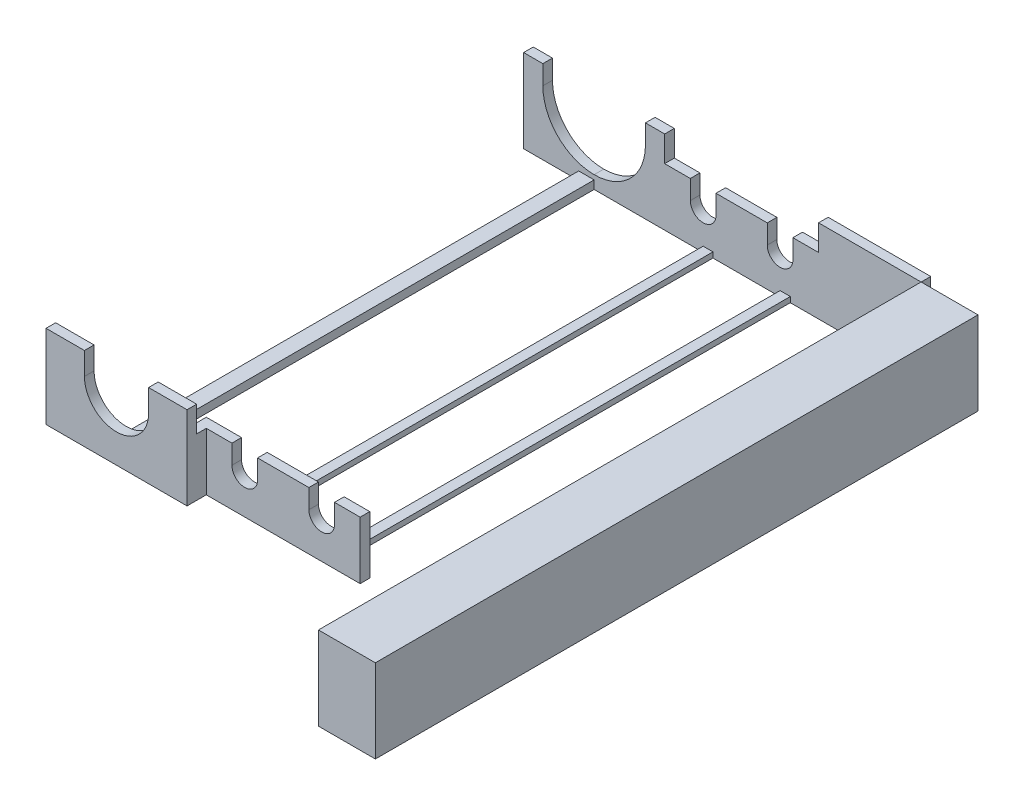
from build123d import *

# Parameters (mm, degrees)
CROQUIS1_W                 = 22
CROQUIS1_H                 = 13
SALIENTE_EXTRUIR1_DEPTH    = 1.5
CORTAR_EXTRUIR1_DEPTH      = 26.597851472
CORTAR_EXTRUIR1_DEPTH_BACK = 26.597851472
CROQUIS3_W                 = 2.414138677
CROQUIS3_H                 = 1.29532468
SALIENTE_EXTRUIR2_DEPTH    = 73
SALIENTE_EXTRUIR3_DEPTH    = 1.5
SALIENTE_EXTRUIR4_DEPTH    = 1.5
SALIENTE_EXTRUIR6_DEPTH    = 1.5
CROQUIS11_W                = 1.535403859
CROQUIS11_H                = 0.841260835
CROQUIS11_W_2              = 1.596700718
SALIENTE_EXTRUIR8_DEPTH    = 70
SALIENTE_EXTRUIR9_START    = 1.5
SALIENTE_EXTRUIR9_DEPTH    = 1.5
CROQUIS13_W                = 3
CROQUIS13_H                = 8.989544026
SALIENTE_EXTRUIR10_DEPTH   = 1.5
CROQUIS16_W                = 16
CROQUIS16_H                = 13
SALIENTE_EXTRUIR11_DEPTH   = 1.5
CROQUIS17_W                = 8.872396733
CROQUIS17_H                = 13
SALIENTE_EXTRUIR13_DEPTH   = 94


with BuildPart() as part:
    # Croquis1 → Saliente-Extruir1 (new body)
    with BuildSketch(Plane.XY):
        with Locations((11, 6.5)):
            Rectangle(CROQUIS1_W, CROQUIS1_H)
    extrude(amount=SALIENTE_EXTRUIR1_DEPTH)

    # Croquis2 → Cortar-Extruir1 (cut, two sides: drawn at the far end of the back side and taken through both)
    with BuildSketch(Plane.XY.offset(1.5).offset(-CORTAR_EXTRUIR1_DEPTH_BACK)):
        with BuildLine():
            Line((3, 13), (3, 10))
            ThreePointArc((3, 10), (5.343145751, 4.343145751), (11, 2))
            ThreePointArc((11, 2), (16.656854249, 4.343145751), (19, 10))
            Line((19, 10), (19, 13))
            Line((19, 13), (3, 13))
        make_face()
    extrude(amount=CORTAR_EXTRUIR1_DEPTH + CORTAR_EXTRUIR1_DEPTH_BACK, mode=Mode.SUBTRACT)

    # Croquis3 → Saliente-Extruir2 (add)
    with BuildSketch(Plane.XY.offset(1.5)):
        with Locations((9.792930662, 0.64766234)):
            Rectangle(CROQUIS3_W, CROQUIS3_H)
    extrude(amount=SALIENTE_EXTRUIR2_DEPTH)

    # Croquis5 → Saliente-Extruir3 (add)
    with BuildSketch(Plane.XY.offset(74.5)):
        with BuildLine():
            Line((6, 9.5), (6, 13))
            Line((6, 13), (0, 13))
            Line((0, 13), (0, 0))
            Line((0, 0), (22, 0))
            Line((22, 0), (22, 13))
            Line((22, 13), (16, 13))
            Line((16, 13), (16, 9.5))
            ThreePointArc((16, 9.5), (11, 4.5), (6, 9.5))
        make_face()
    extrude(amount=SALIENTE_EXTRUIR3_DEPTH)

    # Croquis8 → Saliente-Extruir4 (add)
    with BuildSketch(Plane.XY.offset(1.5)):
        with BuildLine():
            Line((34, 0), (22, 0))
            Line((22, 0), (22, 8.989544026))
            Line((22, 8.989544026), (26, 8.989544026))
            Line((26, 8.989544026), (26, 6))
            ThreePointArc((26, 6), (28, 4), (30, 6))
            Line((30, 6), (30, 8.989544026))
            Line((30, 8.989544026), (34, 8.989544026))
            Line((34, 8.989544026), (34, 0))
        make_face()
    extrude(amount=-SALIENTE_EXTRUIR4_DEPTH)

    # Croquis10 → Saliente-Extruir6 (add)
    with BuildSketch(Plane.XY.offset(1.5)):
        with BuildLine():
            Line((38, 5.989544026), (38, 8.989544026))
            Line((38, 8.989544026), (34, 8.989544026))
            Line((34, 8.989544026), (34, 0))
            Line((34, 0), (46, 0))
            Line((46, 0), (46, 8.989544026))
            Line((46, 8.989544026), (42, 8.989544026))
            Line((42, 8.989544026), (42, 5.989544026))
            ThreePointArc((42, 5.989544026), (40, 3.989544026), (38, 5.989544026))
        make_face()
    extrude(amount=-SALIENTE_EXTRUIR6_DEPTH)

    # Croquis11 → Saliente-Extruir8 (add)
    with BuildSketch(Plane.XY.offset(1.5)):
        with Locations((28.767701929, 0.420630418)):
            Rectangle(CROQUIS11_W, CROQUIS11_H)
        with Locations((40.798350359, 0.420630418)):
            Rectangle(CROQUIS11_W_2, CROQUIS11_H)
    extrude(amount=SALIENTE_EXTRUIR8_DEPTH)

    # Croquis12 → Saliente-Extruir9 (add)
    with BuildSketch(Plane.XY.offset(71.5).offset(SALIENTE_EXTRUIR9_START)):
        with BuildLine():
            Line((26, 8.989544026), (26, 6))
            ThreePointArc((26, 6), (28, 4), (30, 6))
            Line((30, 6), (30, 8.989544026))
            Line((30, 8.989544026), (38, 8.989544026))
            Line((38, 8.989544026), (38, 5.989544026))
            ThreePointArc((38, 5.989544026), (40, 3.989544026), (42, 5.989544026))
            Line((42, 5.989544026), (42, 8.989544026))
            Line((42, 8.989544026), (46, 8.989544026))
            Line((46, 8.989544026), (46, 0))
            Line((46, 0), (22, 0))
            Line((22, 0), (22, 8.989544026))
            Line((22, 8.989544026), (26, 8.989544026))
        make_face()
    extrude(amount=-SALIENTE_EXTRUIR9_DEPTH)

    # Croquis13 → Saliente-Extruir10 (add)
    with BuildSketch(Plane.ZY.offset(-22)):
        with Locations((73, 4.494772013)):
            Rectangle(CROQUIS13_W, CROQUIS13_H)
    extrude(amount=SALIENTE_EXTRUIR10_DEPTH)

    # Croquis16 → Saliente-Extruir11 (add)
    with BuildSketch(Plane.XY.offset(1.5)):
        with Locations((54, 6.5)):
            Rectangle(CROQUIS16_W, CROQUIS16_H)
    extrude(amount=-SALIENTE_EXTRUIR11_DEPTH)


with BuildPart() as body_2:
    # Croquis17 → Saliente-Extruir13 (new body)
    with BuildSketch(Plane.XY.offset(1.5)):
        with Locations((66.436198367, 6.5)):
            Rectangle(CROQUIS17_W, CROQUIS17_H)
    extrude(amount=SALIENTE_EXTRUIR13_DEPTH)


solid = Compound([part.part, body_2.part])
